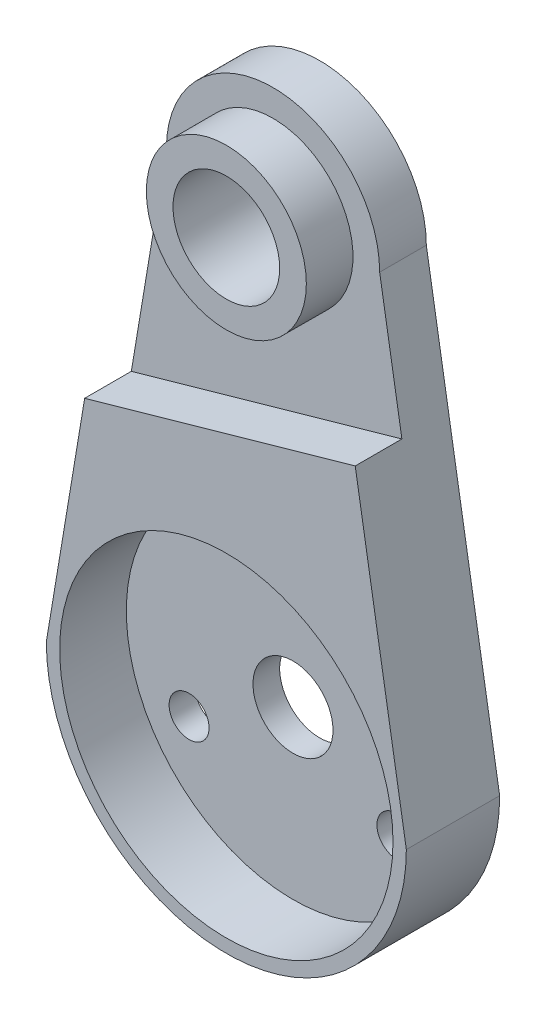
from build123d import *

# Parameters (mm, degrees)
BOSS_EXTRU_1_DEPTH      = 7
ESQUISSE2_R             = 3
ENL_V_MAT_EXTRU_1_DEPTH = 7
ESQUISSE3_R             = 1.5
ENL_V_MAT_EXTRU_2_DEPTH = 7
ESQUISSE5_R             = 12.5
ENL_V_MAT_EXTRU_5_DEPTH = 5
ESQUISSE10_W            = 27
ESQUISSE10_H            = 3.5
ENL_V_MAT_EXTRU_6_DEPTH = 20
ESQUISSE12_R            = 6
BOSS_EXTRU_3_DEPTH      = 3.5
ESQUISSE13_R            = 4
ENL_V_MAT_EXTRU_7_DEPTH = 49.92340953
ENL_V_MAT_EXTRU_8_DEPTH = 3.5


with BuildPart() as part:
    # Esquisse1 → Boss.-Extru.1 (new body)
    with BuildSketch(Plane.XY):
        with BuildLine():
            Line((8, 0), (13.5, -33))
            ThreePointArc((13.5, -33), (0, -46.5), (-13.5, -33))
            Line((-13.5, -33), (-8, 0))
            ThreePointArc((-8, 0), (0, 8), (8, 0))
        make_face()
    extrude(amount=BOSS_EXTRU_1_DEPTH)

    # Esquisse2 → Enlèv. mat.-Extru.1 (cut)
    with BuildSketch(Plane.XY.offset(7)):
        with Locations((0, -33)):
            Circle(ESQUISSE2_R)
    extrude(amount=-ENL_V_MAT_EXTRU_1_DEPTH, mode=Mode.SUBTRACT)

    # Esquisse3 → Enlèv. mat.-Extru.2 (cut)
    with BuildSketch(Plane.XY.offset(7)):
        with Locations((0, -24)):
            Circle(ESQUISSE3_R)
        with Locations((-7.794228634, -37.5)):
            Circle(ESQUISSE3_R)
        with Locations((7.794228634, -37.5)):
            Circle(ESQUISSE3_R)
    extrude(amount=-ENL_V_MAT_EXTRU_2_DEPTH, mode=Mode.SUBTRACT)

    # Esquisse5 → Enlèv. mat.-Extru.5 (cut)
    with BuildSketch(Plane.XY.offset(7)):
        with Locations((0, -33)):
            Circle(ESQUISSE5_R)
    extrude(amount=-ENL_V_MAT_EXTRU_5_DEPTH, mode=Mode.SUBTRACT)

    # Esquisse10 → Enlèv. mat.-Extru.6 (cut)
    with BuildSketch(Plane(origin=(0, 10, 0), x_dir=(1, 0, 0), z_dir=(0, 1, 0))):
        with Locations((0, -5.25)):
            Rectangle(ESQUISSE10_W, ESQUISSE10_H)
    extrude(amount=-ENL_V_MAT_EXTRU_6_DEPTH, mode=Mode.SUBTRACT)

    # Esquisse12 → Boss.-Extru.3 (add)
    with BuildSketch(Plane.XY.offset(3.5)):
        with Locations(Location((0, 0, 0), (0, 0, 180))):
            Circle(ESQUISSE12_R)
    extrude(amount=BOSS_EXTRU_3_DEPTH)

    # Esquisse13 → Enlèv. mat.-Extru.7 (cut, through all)
    with BuildSketch(Plane.XY.offset(7)):
        Circle(ESQUISSE13_R)
    extrude(amount=-ENL_V_MAT_EXTRU_7_DEPTH, mode=Mode.SUBTRACT)

    # Esquisse14 → Enlèv. mat.-Extru.8 (cut)
    with BuildSketch(Plane.XY.offset(7)):
        Polygon((9.666666667, -10), (-10.625, -15.75), (-9.666666667, -10), align=None)
    extrude(amount=-ENL_V_MAT_EXTRU_8_DEPTH, mode=Mode.SUBTRACT)


solid = part.part
